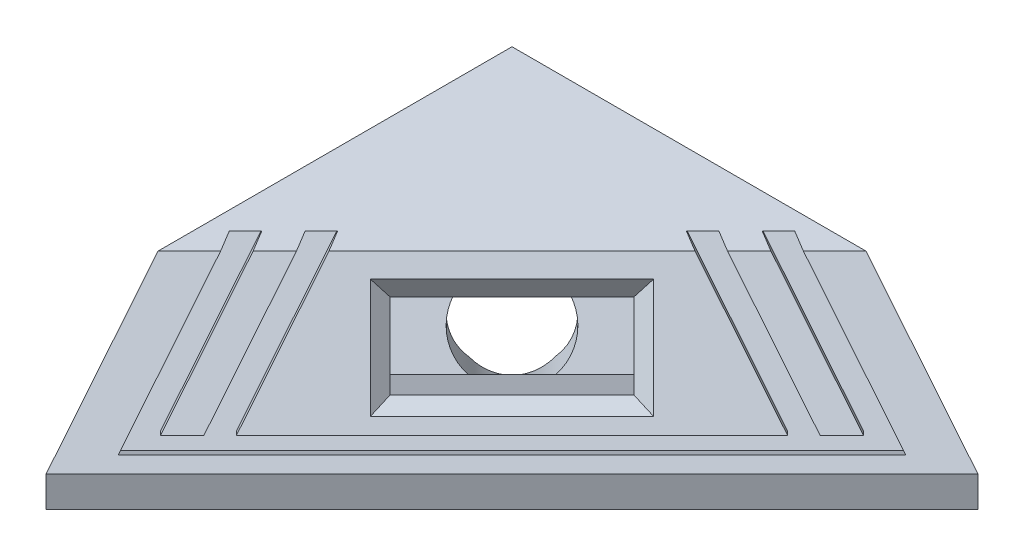
from build123d import *

# Parameters (mm, degrees)
BOSS_EXTRUDE1_DEPTH     = 18
CUT_EXTRUDE2_DEPTH      = 9
CUT_EXTRUDE3_DEPTH      = 30.344292319
CUT_EXTRUDE3_DEPTH_BACK = 12.5
SKETCH6_6_W             = 12.6
SKETCH6_6_H             = 5.1
CUT_EXTRUDE4_DEPTH      = 2.5
CHAMFER1_SIZE           = 10
CHAMFER1_SIZE2          = 5.773502692
CHAMFER2_SIZE           = 1
CUT_EXTRUDE5_START      = -12.5
CUT_EXTRUDE5_DEPTH      = 17.844292319


with BuildPart() as part:
    # Sketch1 → Boss-Extrude1 (new body)
    with BuildSketch(Plane(origin=(0, 0, 0), x_dir=(1, 0, 0), z_dir=(0, 1, 0))):
        Polygon((0, 0), (0, -34), (34, 0), align=None)
    extrude(amount=BOSS_EXTRUDE1_DEPTH)

    # Sketch6 → Cut-Extrude2 (cut)
    # profile 1 of 8: a face of its own
    with BuildSketch(Plane(origin=(15.196708808, 12.408060783, 15.196708808), x_dir=(0.7071067811865475, 0, -0.7071067811865476), z_dir=(0.6123724356957942, 0.5000000000000011, 0.6123724356957941))):
        Polygon((-24.04163056, 7.366311807), (-24.04163056, -5.100477721), (24.04163056, -5.100477721), (24.04163056, 7.366311807), (-8.989412587, 7.366311807), (-14.222807352, -3.100477721), (0, -3.100477721), (0, -4.100477721), (-20.312977295, -4.100477721), (-14.579582531, 7.366311807), align=None)
        with BuildLine():
            ThreePointArc((2.248888614, -1.100477721), (0, -1.950477721), (-2.248888614, -1.100477721))
            Line((-2.248888614, -1.100477721), (-6.3, -1.100477721))
            Line((-6.3, -1.100477721), (-6.3, 3.999522279))
            Line((-6.3, 3.999522279), (-2.248888614, 3.999522279))
            ThreePointArc((-2.248888614, 3.999522279), (0, 4.849522279), (2.248888614, 3.999522279))
            Line((2.248888614, 3.999522279), (6.3, 3.999522279))
            Line((6.3, 3.999522279), (6.3, -1.100477721))
            Line((6.3, -1.100477721), (2.248888614, -1.100477721))
        make_face(mode=Mode.SUBTRACT)
    # profile 2 of 8: a face of its own
    with BuildSketch(Plane(origin=(15.196708808, 12.408060783, 15.196708808), x_dir=(0.7071067811865475, 0, -0.7071067811865476), z_dir=(0.6123724356957942, 0.5000000000000011, 0.6123724356957941))):
        with BuildLine():
            ThreePointArc((3.4, 1.449522279), (3.098888614, 0.050633664), (2.248888614, -1.100477721))
            Line((2.248888614, -1.100477721), (6.3, -1.100477721))
            Line((6.3, -1.100477721), (6.3, 3.999522279))
            Line((6.3, 3.999522279), (2.248888614, 3.999522279))
            ThreePointArc((2.248888614, 3.999522279), (3.098888614, 2.848410893), (3.4, 1.449522279))
        make_face()
    # profile 3 of 8: a face of its own
    with BuildSketch(Plane(origin=(15.196708808, 12.408060783, 15.196708808), x_dir=(0.7071067811865475, 0, -0.7071067811865476), z_dir=(0.6123724356957942, 0.5000000000000011, 0.6123724356957941))):
        with BuildLine():
            Line((-6.3, -1.100477721), (-2.248888614, -1.100477721))
            ThreePointArc((-2.248888614, -1.100477721), (-3.4, 1.449522279), (-2.248888614, 3.999522279))
            Line((-2.248888614, 3.999522279), (-6.3, 3.999522279))
            Line((-6.3, 3.999522279), (-6.3, -1.100477721))
        make_face()
    # profile 4 of 8: a face of its own
    with BuildSketch(Plane(origin=(15.196708808, 12.408060783, 15.196708808), x_dir=(0.7071067811865475, 0, -0.7071067811865476), z_dir=(0.6123724356957942, 0.5000000000000011, 0.6123724356957941))):
        with BuildLine():
            Line((0, -1.100477721), (-2.248888614, -1.100477721))
            ThreePointArc((-2.248888614, -1.100477721), (0, -1.950477721), (2.248888614, -1.100477721))
            Line((2.248888614, -1.100477721), (0, -1.100477721))
        make_face()
    # profile 5 of 8: a face of its own
    with BuildSketch(Plane(origin=(15.196708808, 12.408060783, 15.196708808), x_dir=(0.7071067811865475, 0, -0.7071067811865476), z_dir=(0.6123724356957942, 0.5000000000000011, 0.6123724356957941))):
        with BuildLine():
            ThreePointArc((2.248888614, 3.999522279), (0, 4.849522279), (-2.248888614, 3.999522279))
            Line((-2.248888614, 3.999522279), (0, 3.999522279))
            Line((0, 3.999522279), (2.248888614, 3.999522279))
        make_face()
    # profile 6 of 8: a face of its own
    with BuildSketch(Plane(origin=(15.196708808, 12.408060783, 15.196708808), x_dir=(0.7071067811865475, 0, -0.7071067811865476), z_dir=(0.6123724356957942, 0.5000000000000011, 0.6123724356957941))):
        with BuildLine():
            ThreePointArc((-2.248888614, 3.999522279), (-3.4, 1.449522279), (-2.248888614, -1.100477721))
            Line((-2.248888614, -1.100477721), (0, -1.100477721))
            Line((0, -1.100477721), (2.248888614, -1.100477721))
            ThreePointArc((2.248888614, -1.100477721), (3.098888614, 0.050633664), (3.4, 1.449522279))
            ThreePointArc((3.4, 1.449522279), (3.098888614, 2.848410893), (2.248888614, 3.999522279))
            Line((2.248888614, 3.999522279), (0, 3.999522279))
            Line((0, 3.999522279), (-2.248888614, 3.999522279))
        make_face()
    # profile 7 of 8: a face of its own
    with BuildSketch(Plane(origin=(15.196708808, 12.408060783, 15.196708808), x_dir=(0.7071067811865475, 0, -0.7071067811865476), z_dir=(0.6123724356957942, 0.5000000000000011, 0.6123724356957941))):
        Polygon((-12.902531548, 7.366311807), (-14.579582531, 7.366311807), (-20.312977295, -4.100477721), (0, -4.100477721), (0, -3.100477721), (-14.222807352, -3.100477721), (-8.989412587, 7.366311807), (-10.666463571, 7.366311807), (-15.899858335, -3.100477721), (-18.135926312, -3.100477721), align=None)
    # profile 8 of 8: a face of its own
    with BuildSketch(Plane(origin=(15.196708808, 12.408060783, 15.196708808), x_dir=(0.7071067811865475, 0, -0.7071067811865476), z_dir=(0.6123724356957942, 0.5000000000000011, 0.6123724356957941))):
        Polygon((-10.666463571, 7.366311807), (-12.902531548, 7.366311807), (-18.135926312, -3.100477721), (-15.899858335, -3.100477721), align=None)
    extrude(amount=CUT_EXTRUDE2_DEPTH, mode=Mode.SUBTRACT)

    # Sketch6<6> → Cut-Extrude3 (cut, two sides: drawn at the far end of the back side and taken through both)
    with BuildSketch(Plane(origin=(15.196708808, 12.408060783, 15.196708808), x_dir=(0.7071067811865475, 0, -0.7071067811865476), z_dir=(0.6123724356957942, 0.5000000000000011, 0.6123724356957941)).offset(-CUT_EXTRUDE3_DEPTH_BACK)):
        with Locations((0, 1.449522279)):
            Rectangle(SKETCH6_6_W, SKETCH6_6_H)
    extrude(amount=CUT_EXTRUDE3_DEPTH + CUT_EXTRUDE3_DEPTH_BACK, mode=Mode.SUBTRACT)

    # Sketch6<8> → Cut-Extrude4 (cut)
    with BuildSketch(Plane(origin=(15.196708808, 12.408060783, 15.196708808), x_dir=(0.7071067811865475, 0, -0.7071067811865476), z_dir=(0.6123724356957942, 0.5000000000000011, 0.6123724356957941))):
        Polygon((-12.902531548, 7.366311807), (-14.579582531, 7.366311807), (-20.312977295, -4.100477721), (0, -4.100477721), (0, -3.100477721), (-14.222807352, -3.100477721), (-8.989412587, 7.366311807), (-10.666463571, 7.366311807), (-15.899858335, -3.100477721), (-18.135926312, -3.100477721), align=None)
    cut_extrude4 = extrude(amount=-CUT_EXTRUDE4_DEPTH, mode=Mode.SUBTRACT)

    # Mirror1: Cut-Extrude4 across plane
    add(cut_extrude4.mirror(Plane(origin=(0, 0, 0), x_dir=(0.7071067811865476, 0, 0.7071067811865476), z_dir=(-0.7071067811865477, 0, 0.7071067811865475))), mode=Mode.SUBTRACT)

    # Chamfer1
    chamfer1_edges = [part.edges().sort_by_distance(p)[0] for p in [
        (17, 0, 17),
    ]]
    chamfer1_side = [part.faces().sort_by_distance(p)[0] for p in [
        (11.333333333, 0, 11.333333333),
    ]]
    chamfer(chamfer1_edges, length=CHAMFER1_SIZE, length2=CHAMFER1_SIZE2, reference=chamfer1_side[0])

    # Chamfer2
    chamfer2_edges = [part.edges().sort_by_distance(p)[0] for p in [
        (19.138998013, 13.6633839, 10.22945257),
        (15.585786438, 11.45501912, 15.585786438),
        (10.22945257, 13.6633839, 19.138998013),
        (13.782664146, 15.871748679, 13.782664146),
    ]]
    chamfer(chamfer2_edges, length=CHAMFER2_SIZE)

    # Sketch6<9> → Cut-Extrude5 (cut, through all)
    with BuildSketch(Plane(origin=(15.196708808, 12.408060783, 15.196708808), x_dir=(0.7071067811865475, 0, -0.7071067811865476), z_dir=(0.6123724356957942, 0.5000000000000011, 0.6123724356957941)).offset(CUT_EXTRUDE5_START)):
        with BuildLine():
            ThreePointArc((2.248888614, 3.999522279), (0, 4.849522279), (-2.248888614, 3.999522279))
            Line((-2.248888614, 3.999522279), (0, 3.999522279))
            Line((0, 3.999522279), (2.248888614, 3.999522279))
        make_face()
        with BuildLine():
            ThreePointArc((-2.248888614, 3.999522279), (-3.4, 1.449522279), (-2.248888614, -1.100477721))
            Line((-2.248888614, -1.100477721), (0, -1.100477721))
            Line((0, -1.100477721), (2.248888614, -1.100477721))
            ThreePointArc((2.248888614, -1.100477721), (3.098888614, 0.050633664), (3.4, 1.449522279))
            ThreePointArc((3.4, 1.449522279), (3.098888614, 2.848410893), (2.248888614, 3.999522279))
            Line((2.248888614, 3.999522279), (0, 3.999522279))
            Line((0, 3.999522279), (-2.248888614, 3.999522279))
        make_face()
        with BuildLine():
            Line((0, -1.100477721), (-2.248888614, -1.100477721))
            ThreePointArc((-2.248888614, -1.100477721), (0, -1.950477721), (2.248888614, -1.100477721))
            Line((2.248888614, -1.100477721), (0, -1.100477721))
        make_face()
    extrude(amount=-CUT_EXTRUDE5_DEPTH, mode=Mode.SUBTRACT)


solid = part.part
